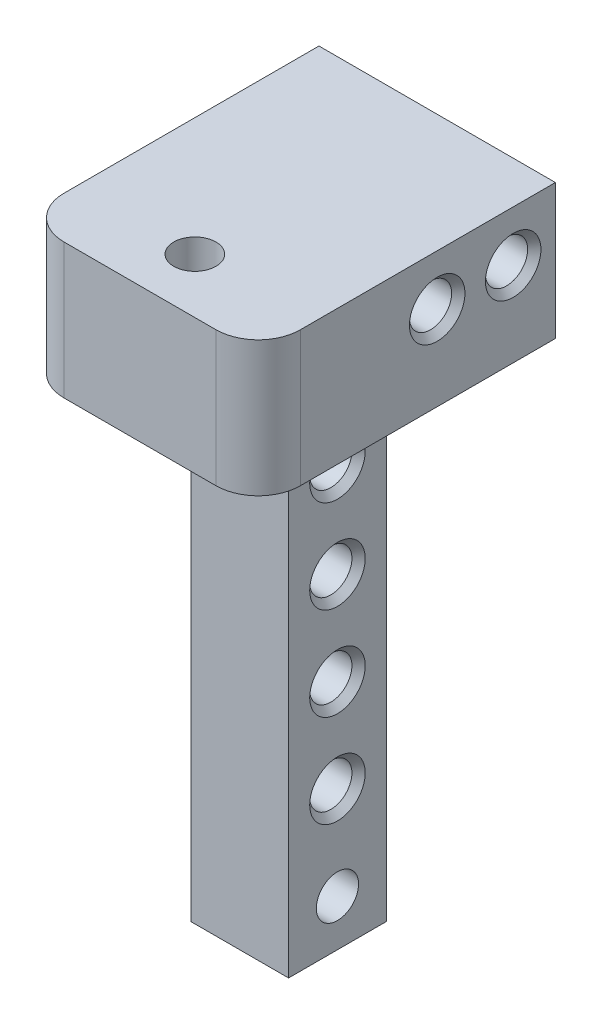
from build123d import *

# Parameters (mm, degrees)
SKETCH1_W                 = 14.7
SKETCH1_H                 = 14.7
BOSS_EXTRUDE1_DEPTH       = 76.2
SKETCH6_R                 = 3.175
CUT_EXTRUDE4_DEPTH        = 78.952244997
CHAMFER5_SIZE             = 1
CHAMFER6_SIZE             = 2.54
BOSS_EXTRUDE2_DEPTH       = 15
BOSS_EXTRUDE2_DEPTH_BACK  = 29.7
SKETCH4_W                 = 35.56
SKETCH4_H                 = 20.32
SKETCH5_R                 = 3.175
TRAYSUPPORTMOUNTING_DEPTH = 106.262274819
CHAMFER4_SIZE             = 1
CUT_EXTRUDE2_REACH        = 102.657
SKETCH3_R                 = 3.175
FILLET1_R                 = 6.35


with BuildPart() as part:
    # Sketch1 → Boss-Extrude1 (new body)
    with BuildSketch(Plane(origin=(0, 0, 0), x_dir=(1, 0, 0), z_dir=(0, 1, 0))):
        Rectangle(SKETCH1_W, SKETCH1_H)
    extrude(amount=BOSS_EXTRUDE1_DEPTH)

    # Sketch6 → Cut-Extrude4 (cut, through all)
    with BuildSketch(Plane(origin=(7.35, 0, 0), x_dir=(0, 0, -1), z_dir=(1, 0, 0))):
        with Locations((0, 65.405)):
            Circle(SKETCH6_R)
        with Locations((0, 51.435)):
            Circle(SKETCH6_R)
        with Locations((0, 37.465)):
            Circle(SKETCH6_R)
        with Locations((0, 23.495)):
            Circle(SKETCH6_R)
        with Locations((0, 9.525)):
            Circle(SKETCH6_R)
    extrude(amount=-CUT_EXTRUDE4_DEPTH, mode=Mode.SUBTRACT)

    # Chamfer5
    chamfer5_edges = [part.edges().sort_by_distance(p)[0] for p in [
        (-7.35, 23.495, 3.175),
        (7.35, 23.495, 3.175),
        (-7.35, 37.465, 3.175),
        (7.35, 37.465, 3.175),
        (-7.35, 51.435, 3.175),
        (7.35, 51.435, 3.175),
        (-7.35, 65.405, 3.175),
        (7.35, 65.405, 3.175),
    ]]
    chamfer(chamfer5_edges, length=CHAMFER5_SIZE)

    # Chamfer6
    chamfer6_edges = [part.edges().sort_by_distance(p)[0] for p in [
        (0, 0, 7.35),
        (7.35, 0, 0),
        (0, 0, -7.35),
        (-7.35, 0, 0),
    ]]
    chamfer(chamfer6_edges, length=CHAMFER6_SIZE)

    # Sketch4 → Boss-Extrude2 (add, two sides: drawn at the far end of the back side and taken through both)
    with BuildSketch(Plane.XY.offset(7.35).offset(-BOSS_EXTRUDE2_DEPTH_BACK)):
        with Locations((0, 86.36)):
            Rectangle(SKETCH4_W, SKETCH4_H)
    extrude(amount=BOSS_EXTRUDE2_DEPTH + BOSS_EXTRUDE2_DEPTH_BACK)

    # Sketch5 → TraySupportMounting (cut, through all)
    with BuildSketch(Plane(origin=(17.78, 0, 0), x_dir=(0, 0, -1), z_dir=(1, 0, 0))):
        with Locations((16, 88.9)):
            Circle(SKETCH5_R)
        with Locations((4.57, 88.9)):
            Circle(SKETCH5_R)
    extrude(amount=-TRAYSUPPORTMOUNTING_DEPTH, mode=Mode.SUBTRACT)

    # Chamfer4
    chamfer4_edges = [part.edges().sort_by_distance(p)[0] for p in [
        (17.78, 88.9, -1.395),
        (-17.78, 88.9, -1.395),
        (17.78, 88.9, -12.825),
        (-17.78, 88.9, -12.825),
    ]]
    chamfer(chamfer4_edges, length=CHAMFER4_SIZE)

    # Sketch3 → Cut-Extrude2 (cut, up to next)
    with BuildSketch(Plane(origin=(0, 96.52, 0), x_dir=(1, 0, 0), z_dir=(0, 1, 0)), mode=Mode.PRIVATE) as cut_extrude2_sk1:
        with Locations((0, -14.095)):
            Circle(SKETCH3_R)
    cut_extrude2_tool1 = extrude(cut_extrude2_sk1.sketch, amount=-CUT_EXTRUDE2_REACH, mode=Mode.PRIVATE) & part.part
    add(cut_extrude2_tool1.solids().sort_by_distance((0, 96.52, 14.095))[0], mode=Mode.SUBTRACT)

    # Fillet1
    fillet1_edges = [part.edges().sort_by_distance(p)[0] for p in [
        (-17.78, 86.36, 22.35),
        (17.78, 86.36, 22.35),
    ]]
    fillet(fillet1_edges, radius=FILLET1_R)


solid = part.part
